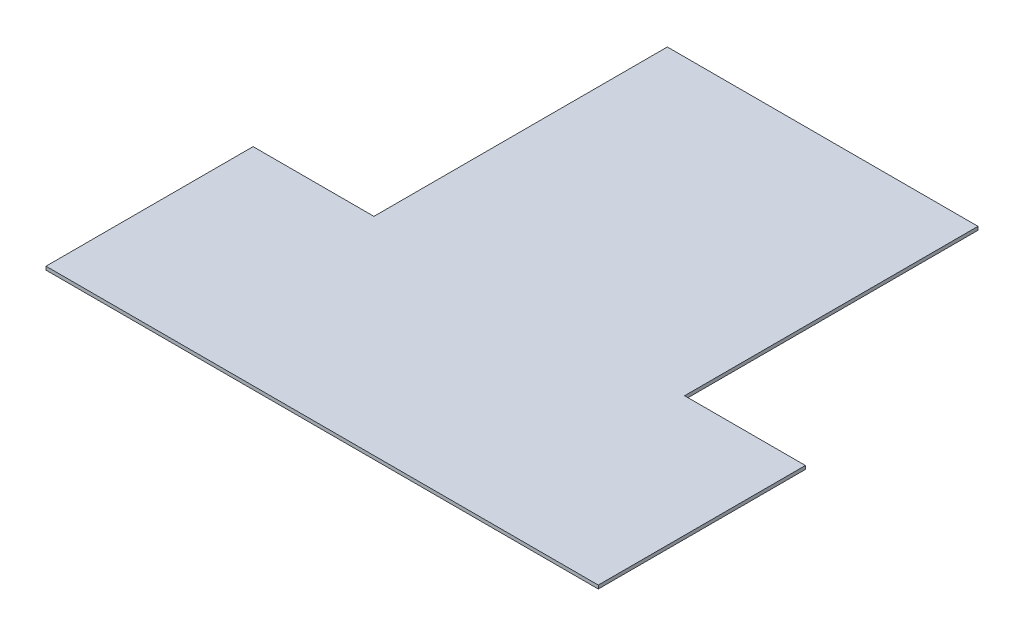
from build123d import *

# Parameters (mm, degrees)
EXTRUDE1_DEPTH = 2.54


with BuildPart() as part:
    # Sketch1 → Extrude1 (new body)
    with BuildSketch(Plane(origin=(0, 0, 0), x_dir=(1, 0, 0), z_dir=(0, 1, 0))):
        Polygon((-45.996932202, -156.777680579), (-45.996932202, 59.122319421), (182.603067798, 59.122319421), (182.603067798, -156.777680579), (271.503067798, -156.777680579), (271.503067798, -309.177680579), (-134.896932202, -309.177680579), (-134.896932202, -156.777680579), align=None)
    extrude(amount=EXTRUDE1_DEPTH)


solid = part.part
